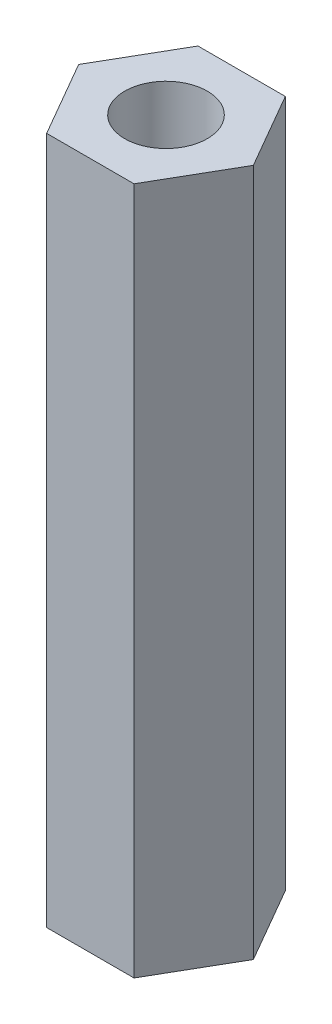
from build123d import *

# Parameters (mm, degrees)
BOSS_EXTRUDE1_DEPTH = 25
SKETCH2_R           = 1.5
CUT_EXTRUDE1_DEPTH  = 10


with BuildPart() as part:
    # Sketch1 → Boss-Extrude1 (new body)
    with BuildSketch(Plane(origin=(0, 0, 0), x_dir=(1, 0, 0), z_dir=(0, 1, 0))):
        Polygon((3.175426481, 0), (1.58771324, 2.75), (-1.58771324, 2.75), (-3.175426481, 0), (-1.58771324, -2.75), (1.58771324, -2.75), align=None)
    extrude(amount=BOSS_EXTRUDE1_DEPTH)

    # Sketch2 → Cut-Extrude1 (cut)
    with BuildSketch(Plane(origin=(0, 25, 0), x_dir=(1, 0, 0), z_dir=(0, 1, 0))):
        with Locations(Location((0, 0, 0), (0, 0, 270))):
            Circle(SKETCH2_R)
    cut_extrude1 = extrude(amount=-CUT_EXTRUDE1_DEPTH, mode=Mode.SUBTRACT)

    # Mirror1: Cut-Extrude1 across plane
    add(cut_extrude1.mirror(Plane(origin=(0, 12.5, 0), x_dir=(0, 0, 1), z_dir=(0, -1, 0))), mode=Mode.SUBTRACT)


solid = part.part
